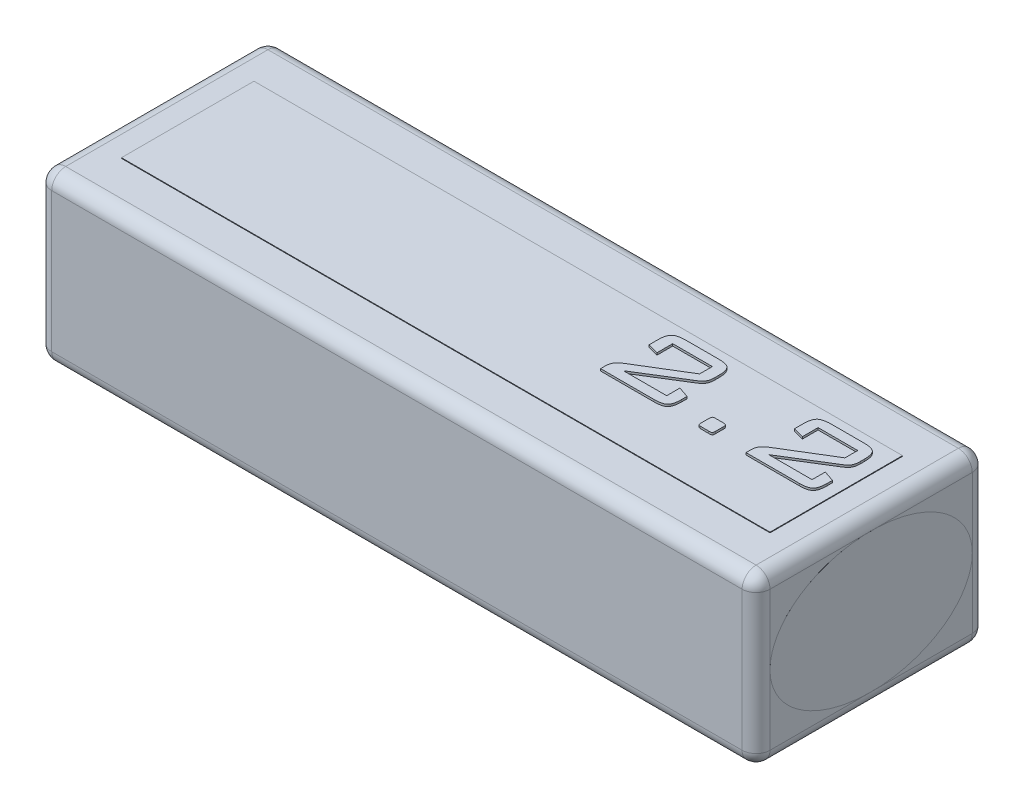
from build123d import *

# Parameters (mm, degrees)
ESBO_O1_W                  = 103
ESBO_O1_H                  = 33
RESSALTO_EXTRUS_O1_DEPTH   = 24
FILETE1_R                  = 2
ESBO_O4_RX                 = 14.5
ESBO_O4_RY                 = 10
RESSALTO_EXTRUS_O3_DEPTH   = 0.001
ESBO_O5_RX                 = 14.508383713
ESBO_O5_RY                 = 10.005781871
RESSALTO_EXTRUS_O4_DEPTH   = 0.001
ESBO_O6_W                  = 93
ESBO_O6_H                  = 19
RESSALTO_EXTRUS_O5_DEPTH   = 0.09
RESSALTO_EXTRUS_O6_DEPTH   = 0.3
RESSALTO_EXTRUS_O6_2_DEPTH = 0.3
RESSALTO_EXTRUS_O6_3_DEPTH = 0.3


with BuildPart() as part:
    # Esboço1 → Ressalto-extrusão1 (new body)
    with BuildSketch(Plane(origin=(0, 0, 0), x_dir=(1, 0, 0), z_dir=(0, 1, 0))):
        with Locations((-49.434832339, -22.419016433)):
            Rectangle(ESBO_O1_W, ESBO_O1_H)
    extrude(amount=RESSALTO_EXTRUS_O1_DEPTH)

    # Filete1
    filete1_edges = [part.edges().sort_by_distance(p)[0] for p in [
        (2.065167661, 24, 22.419016433),
        (-49.434832339, 24, 5.919016433),
        (-100.934832339, 24, 22.419016433),
        (-49.434832339, 0, 5.919016433),
        (2.065167661, 0, 22.419016433),
        (-49.434832339, 0, 38.919016433),
        (-100.934832339, 0, 22.419016433),
        (-49.434832339, 24, 38.919016433),
        (-100.934832339, 12, 5.919016433),
        (2.065167661, 12, 5.919016433),
        (2.065167661, 12, 38.919016433),
        (-100.934832339, 12, 38.919016433),
    ]]
    fillet(filete1_edges, radius=FILETE1_R)


with BuildPart() as body_2:
    # Esboço4 → Ressalto-extrusão3 (new body)
    with BuildSketch(Plane(origin=(2.065167661, 0, 0), x_dir=(0, 0, -1), z_dir=(1, 0, 0))):
        with Locations((-22.419016433, 12)):
            Ellipse(ESBO_O4_RX, ESBO_O4_RY)
    extrude(amount=RESSALTO_EXTRUS_O3_DEPTH)


with BuildPart() as body_3:
    # Esboço5 → Ressalto-extrusão4 (new body)
    with BuildSketch(Plane.ZY.offset(100.934832339)):
        with Locations(Location((22.419016433, 12), (0, 0, 178.052097389))):
            Ellipse(ESBO_O5_RX, ESBO_O5_RY)
    extrude(amount=RESSALTO_EXTRUS_O4_DEPTH)


with BuildPart() as body_4:
    # Esboço6 → Ressalto-extrusão5 (new body)
    with BuildSketch(Plane(origin=(0, 24, 0), x_dir=(1, 0, 0), z_dir=(0, 1, 0))):
        with Locations((-49.434832339, -22.419016433)):
            Rectangle(ESBO_O6_W, ESBO_O6_H)
    extrude(amount=RESSALTO_EXTRUS_O5_DEPTH)


with BuildPart() as body_5:
    # Esboço7 → Ressalto-extrusão6 (new body)
    with BuildSketch(Plane(origin=(0, 24.09, 0), x_dir=(1, 0, 0), z_dir=(0, 1, 0))):
        with BuildLine():
            add(Edge.make_bspline(
                [(-34.569489175, -16.382666091), (-34.569159217, -16.29195482), (-34.568527629, -16.118319912), (-34.544365709, -15.86874775), (-34.515567084, -15.640345677), (-34.466072737, -15.435428235), (-34.406847229, -15.252257331), (-34.336359257, -15.089356146), (-34.245765536, -14.951314355), (-34.143989878, -14.83123272), (-34.022466134, -14.728065826), (-33.87302629, -14.645915671), (-33.700796519, -14.573354334), (-33.502915273, -14.515045774), (-33.281336733, -14.469616048), (-33.034657833, -14.439018811), (-32.762530046, -14.415737968), (-32.571897747, -14.41501136), (-32.472226548, -14.414631456)],
                knots=[0, 0, 0, 0, 1.278301308, 2.446859446, 3.533112492, 4.521418979, 5.41377048, 6.246340027, 7.015009992, 7.732836924, 8.460302522, 9.248208924, 10.127181626, 11.091958512, 12.151648054, 13.313127913, 14.595181581, 16, 16, 16, 16], degree=3))
            Line((-32.472226548, -14.414631456), (-27.817326569, -14.414631456))
            add(Edge.make_bspline(
                [(-27.817326569, -14.414631456), (-27.721240632, -14.415010804), (-27.536873435, -14.415738687), (-27.272865163, -14.439256483), (-27.033200791, -14.469156203), (-26.81814253, -14.515584003), (-26.626855111, -14.572482852), (-26.461007909, -14.647250322), (-26.315334189, -14.727961011), (-26.196594694, -14.831365734), (-26.097656485, -14.951485252), (-26.009527359, -15.089507646), (-25.942728474, -15.252931921), (-25.88171909, -15.434956711), (-25.836992145, -15.64081293), (-25.80677609, -15.868667519), (-25.783042451, -16.118342848), (-25.78234832, -16.291962691), (-25.781985688, -16.382666091)],
                knots=[0, 0, 0, 0, 1.375990778, 2.64021531, 3.794885832, 4.833878501, 5.789579487, 6.647280451, 7.436733976, 8.166105683, 8.887157072, 9.661279942, 10.502045168, 11.408748313, 12.410064635, 13.513787834, 14.701139836, 16, 16, 16, 16], degree=3))
            Line((-25.781985688, -16.382666091), (-25.781985688, -16.980345556))
            add(Edge.make_bspline(
                [(-25.781985688, -16.980345556), (-25.785312469, -17.089031986), (-25.791583018, -17.293891707), (-25.831816496, -17.584641476), (-25.910414719, -17.835289496), (-26.018062275, -18.061449596), (-26.18781418, -18.262360333), (-26.413625817, -18.465763433), (-26.708129534, -18.675430315), (-26.932305041, -18.809210124), (-27.052727614, -18.881073946)],
                knots=[0, 0, 0, 0, 1.068072904, 2.0131779, 2.872024017, 3.64085674, 4.455963523, 5.435674887, 6.622496136, 8, 8, 8, 8], degree=3))
            Line((-27.052727614, -18.881073946), (-33.185672756, -22.685222974))
            Line((-33.185672756, -22.685222974), (-26.988113617, -22.685222974))
            Line((-26.988113617, -22.685222974), (-26.988113617, -20.789879084))
            Line((-26.988113617, -20.789879084), (-25.437377708, -21.309483304))
            Line((-25.437377708, -21.309483304), (-25.437377708, -22.101004758))
            add(Edge.make_bspline(
                [(-25.437377708, -22.101004758), (-25.438133978, -22.191671358), (-25.439580983, -22.365147836), (-25.458076763, -22.614345869), (-25.491125128, -22.840612779), (-25.531287256, -23.047158565), (-25.592344954, -23.228731214), (-25.657363658, -23.391961353), (-25.742427254, -23.529088862), (-25.837364026, -23.649910673), (-25.955883965, -23.748656305), (-26.092869914, -23.835259025), (-26.255451379, -23.90415107), (-26.438994922, -23.963670952), (-26.647399937, -24.008673372), (-26.879733316, -24.039189134), (-27.134829877, -24.062451849), (-27.312918804, -24.063243655), (-27.405412343, -24.063654893)],
                knots=[0, 0, 0, 0, 1.322689688, 2.53076158, 3.641770924, 4.658680015, 5.594466799, 6.433464818, 7.214909826, 7.940854285, 8.665143763, 9.45346907, 10.297661543, 11.233448327, 12.265916855, 13.402855782, 14.651128604, 16, 16, 16, 16], degree=3))
            Line((-27.405412343, -24.063654893), (-35.086401145, -24.063654893))
            Line((-35.086401145, -24.063654893), (-35.086401145, -23.43636068))
            add(Edge.make_bspline(
                [(-35.086401145, -23.43636068), (-35.084250484, -23.327481698), (-35.080184881, -23.121657305), (-35.025294355, -22.834416933), (-34.941515987, -22.585806648), (-34.813592283, -22.373817878), (-34.641799183, -22.185508418), (-34.430278922, -21.999151722), (-34.176774442, -21.803979876), (-33.986346445, -21.683039312), (-33.885657715, -21.619092036)],
                knots=[0, 0, 0, 0, 1.128600693, 2.133502256, 3.023347132, 3.838149688, 4.682967801, 5.659309701, 6.762360903, 8, 8, 8, 8], degree=3))
            Line((-33.885657715, -21.619092036), (-27.332721597, -17.621101019))
            Line((-27.332721597, -17.621101019), (-27.332721597, -15.793063376))
            Line((-27.332721597, -15.793063376), (-33.018753266, -15.793063376))
            Line((-33.018753266, -15.793063376), (-33.018753266, -18.033015245))
            Line((-33.018753266, -18.033015245), (-34.569489175, -17.623793269))
            Line((-34.569489175, -17.623793269), (-34.569489175, -16.382666091))
        make_face()
    extrude(amount=RESSALTO_EXTRUS_O6_DEPTH)


with BuildPart() as body_6:
    # Esboço7 → Ressalto-extrus_o6 2 (new body)
    with BuildSketch(Plane(origin=(0, 24.09, 0), x_dir=(1, 0, 0), z_dir=(0, 1, 0))):
        with BuildLine():
            add(Edge.make_bspline(
                [(-19.630194796, -21.996007014), (-19.570880606, -21.996441733), (-19.464434134, -21.997221888), (-19.324398168, -22.015678332), (-19.220110317, -22.04121003), (-19.146778848, -22.087920251), (-19.108163548, -22.160750834), (-19.078464587, -22.250358029), (-19.064841828, -22.368101861), (-19.06309217, -22.454591549), (-19.062130079, -22.502149985)],
                knots=[0, 0, 0, 0, 1.538796082, 2.761555265, 3.661116975, 4.314056044, 4.941546075, 5.752190709, 6.763987982, 8, 8, 8, 8], degree=3))
            Line((-19.062130079, -22.502149985), (-19.062130079, -23.576357672))
            add(Edge.make_bspline(
                [(-19.062130079, -23.576357672), (-19.063231582, -23.623920888), (-19.065211511, -23.709414861), (-19.076945407, -23.824717444), (-19.099847531, -23.912315933), (-19.135408861, -23.982680074), (-19.209563609, -24.023959434), (-19.313801902, -24.046303761), (-19.458385886, -24.061765061), (-19.568230268, -24.062973307), (-19.630194796, -24.063654893)],
                knots=[0, 0, 0, 0, 1.241128253, 2.230904361, 3.008784951, 3.606767329, 4.216987069, 5.136494925, 6.3846626, 8, 8, 8, 8], degree=3))
            Line((-19.630194796, -24.063654893), (-20.755555231, -24.063654893))
            add(Edge.make_bspline(
                [(-20.755555231, -24.063654893), (-20.78881555, -24.062758805), (-20.850418408, -24.061099121), (-20.934566012, -24.046057373), (-21.001884681, -24.019103669), (-21.057076508, -23.97893753), (-21.092356623, -23.912699523), (-21.114849168, -23.824570463), (-21.126736957, -23.709467234), (-21.128690909, -23.623939609), (-21.129777959, -23.576357672)],
                knots=[0, 0, 0, 0, 1.0915796, 2.02176115, 2.787698927, 3.459470797, 4.212265808, 5.191533172, 6.43755403, 8, 8, 8, 8], degree=3))
            Line((-21.129777959, -23.576357672), (-21.129777959, -22.502149985))
            add(Edge.make_bspline(
                [(-21.129777959, -22.502149985), (-21.128952764, -22.454552051), (-21.127452066, -22.367990534), (-21.112354892, -22.25095318), (-21.086905629, -22.160405733), (-21.047497398, -22.086971602), (-20.972104889, -22.042093919), (-20.867683306, -22.015384182), (-20.727410426, -21.997329548), (-20.621004718, -21.996480257), (-20.561713242, -21.996007014)],
                knots=[0, 0, 0, 0, 1.23413041, 2.244387401, 3.04674342, 3.67327821, 4.344456423, 5.242648711, 6.463546461, 8, 8, 8, 8], degree=3))
            Line((-20.561713242, -21.996007014), (-19.630194796, -21.996007014))
        make_face()
    extrude(amount=RESSALTO_EXTRUS_O6_2_DEPTH)


with BuildPart() as body_7:
    # Esboço7 → Ressalto-extrus_o6 3 (new body)
    with BuildSketch(Plane(origin=(0, 24.09, 0), x_dir=(1, 0, 0), z_dir=(0, 1, 0))):
        with BuildLine():
            add(Edge.make_bspline(
                [(-13.720706391, -16.382666091), (-13.720376433, -16.29195482), (-13.719744844, -16.118319912), (-13.695582925, -15.86874775), (-13.6667843, -15.640345677), (-13.617289953, -15.435428235), (-13.558064444, -15.252257331), (-13.487576472, -15.089356146), (-13.396982751, -14.951314355), (-13.295207094, -14.83123272), (-13.17368335, -14.728065826), (-13.024243506, -14.645915671), (-12.852013735, -14.573354334), (-12.654132489, -14.515045774), (-12.432553949, -14.469616048), (-12.185875048, -14.439018811), (-11.913747262, -14.415737968), (-11.723114963, -14.41501136), (-11.623443763, -14.414631456)],
                knots=[0, 0, 0, 0, 1.278301308, 2.446859446, 3.533112492, 4.521418979, 5.41377048, 6.246340027, 7.015009992, 7.732836924, 8.460302522, 9.248208924, 10.127181626, 11.091958512, 12.151648054, 13.313127913, 14.595181581, 16, 16, 16, 16], degree=3))
            Line((-11.623443763, -14.414631456), (-6.968543784, -14.414631456))
            add(Edge.make_bspline(
                [(-6.968543784, -14.414631456), (-6.872457847, -14.415010804), (-6.688090651, -14.415738687), (-6.424082379, -14.439256483), (-6.184418006, -14.469156203), (-5.969359745, -14.515584003), (-5.778072327, -14.572482852), (-5.612225124, -14.647250322), (-5.466551404, -14.727961011), (-5.34781191, -14.831365734), (-5.248873701, -14.951485252), (-5.160744574, -15.089507646), (-5.093945689, -15.252931921), (-5.032936305, -15.434956711), (-4.988209361, -15.64081293), (-4.957993306, -15.868667519), (-4.934259666, -16.118342848), (-4.933565535, -16.291962691), (-4.933202903, -16.382666091)],
                knots=[0, 0, 0, 0, 1.375990778, 2.64021531, 3.794885832, 4.833878501, 5.789579487, 6.647280451, 7.436733976, 8.166105683, 8.887157072, 9.661279942, 10.502045168, 11.408748313, 12.410064635, 13.513787834, 14.701139836, 16, 16, 16, 16], degree=3))
            Line((-4.933202903, -16.382666091), (-4.933202903, -16.980345556))
            add(Edge.make_bspline(
                [(-4.933202903, -16.980345556), (-4.936529685, -17.089031986), (-4.942800234, -17.293891707), (-4.983033711, -17.584641476), (-5.061631934, -17.835289496), (-5.16927949, -18.061449596), (-5.339031395, -18.262360333), (-5.564843033, -18.465763433), (-5.85934675, -18.675430315), (-6.083522256, -18.809210124), (-6.203944829, -18.881073946)],
                knots=[0, 0, 0, 0, 1.068072904, 2.0131779, 2.872024017, 3.64085674, 4.455963523, 5.435674887, 6.622496136, 8, 8, 8, 8], degree=3))
            Line((-6.203944829, -18.881073946), (-12.336889971, -22.685222974))
            Line((-12.336889971, -22.685222974), (-6.139330833, -22.685222974))
            Line((-6.139330833, -22.685222974), (-6.139330833, -20.789879084))
            Line((-6.139330833, -20.789879084), (-4.588594923, -21.309483304))
            Line((-4.588594923, -21.309483304), (-4.588594923, -22.101004758))
            add(Edge.make_bspline(
                [(-4.588594923, -22.101004758), (-4.589351193, -22.191671358), (-4.590798198, -22.365147836), (-4.609293978, -22.614345869), (-4.642342343, -22.840612779), (-4.682504472, -23.047158565), (-4.74356217, -23.228731214), (-4.808580874, -23.391961353), (-4.893644469, -23.529088862), (-4.988581241, -23.649910673), (-5.107101181, -23.748656305), (-5.24408713, -23.835259025), (-5.406668595, -23.90415107), (-5.590212137, -23.963670952), (-5.798617152, -24.008673372), (-6.030950531, -24.039189134), (-6.286047093, -24.062451849), (-6.46413602, -24.063243655), (-6.556629558, -24.063654893)],
                knots=[0, 0, 0, 0, 1.322689688, 2.53076158, 3.641770924, 4.658680015, 5.594466799, 6.433464818, 7.214909826, 7.940854285, 8.665143763, 9.45346907, 10.297661543, 11.233448327, 12.265916855, 13.402855782, 14.651128604, 16, 16, 16, 16], degree=3))
            Line((-6.556629558, -24.063654893), (-14.237618361, -24.063654893))
            Line((-14.237618361, -24.063654893), (-14.237618361, -23.43636068))
            add(Edge.make_bspline(
                [(-14.237618361, -23.43636068), (-14.235467699, -23.327481698), (-14.231402097, -23.121657305), (-14.17651157, -22.834416933), (-14.092733203, -22.585806648), (-13.964809498, -22.373817878), (-13.793016398, -22.185508418), (-13.581496137, -21.999151722), (-13.327991658, -21.803979876), (-13.137563661, -21.683039312), (-13.036874931, -21.619092036)],
                knots=[0, 0, 0, 0, 1.128600693, 2.133502256, 3.023347132, 3.838149688, 4.682967801, 5.659309701, 6.762360903, 8, 8, 8, 8], degree=3))
            Line((-13.036874931, -21.619092036), (-6.483938813, -17.621101019))
            Line((-6.483938813, -17.621101019), (-6.483938813, -15.793063376))
            Line((-6.483938813, -15.793063376), (-12.169970481, -15.793063376))
            Line((-12.169970481, -15.793063376), (-12.169970481, -18.033015245))
            Line((-12.169970481, -18.033015245), (-13.720706391, -17.623793269))
            Line((-13.720706391, -17.623793269), (-13.720706391, -16.382666091))
        make_face()
    extrude(amount=RESSALTO_EXTRUS_O6_3_DEPTH)


solid = Compound([part.part, body_2.part, body_3.part, body_4.part, body_5.part, body_6.part, body_7.part])
